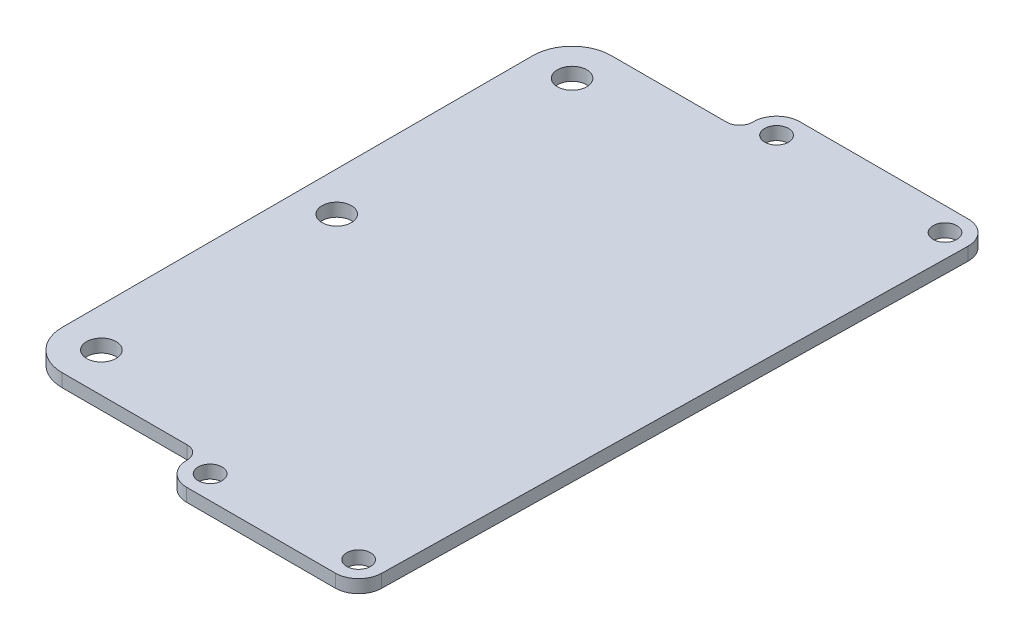
from build123d import *

# Parameters (mm, degrees)
BOSS_EXTRUDE1_START     = -12.827
BOSS_EXTRUDE1_DEPTH     = 3.175
M5_CLEARANCE_HOLE1_D    = 5.8
F_1_4_CLEARANCE_HOLE1_D = 7.14248
FILLET1_R               = 3.175


with BuildPart() as part:
    # Sketch1 → Boss-Extrude1 (new body)
    with BuildSketch(Plane(origin=(0, 144.904574554, 0), x_dir=(1, 0, 0), z_dir=(0, 1, 0)).offset(BOSS_EXTRUDE1_START)):
        with BuildLine():
            Line((-78.14945, -1144.867512521), (-37.25545, -1144.867512521))
            ThreePointArc((-37.25545, -1144.867512521), (-33.208181466, -1146.564417216), (-31.581293209, -1150.640334625))
            Line((-31.581293209, -1150.640334625), (-33.994293209, -1290.605977985))
            ThreePointArc((-33.994293209, -1290.605977985), (-35.690354742, -1294.555424368), (-39.66845, -1296.183155787))
            Line((-39.66845, -1296.183155787), (-75.73645, -1296.183155787))
            ThreePointArc((-75.73645, -1296.183155787), (-79.714545258, -1294.555424368), (-81.410606791, -1290.605977985))
            Line((-81.410606791, -1290.605977985), (-81.469319904, -1287.200334154))
            Line((-81.469319904, -1287.200334154), (-114.966812484, -1287.200334154))
            ThreePointArc((-114.966812484, -1287.200334154), (-121.702004575, -1284.410526245), (-124.491812484, -1277.675334154))
            Line((-124.491812484, -1277.675334154), (-124.491812484, -1220.525334154))
            Line((-124.491812484, -1220.525334154), (-124.491812484, -1163.375334154))
            ThreePointArc((-124.491812484, -1163.375334154), (-121.702004575, -1156.640142063), (-114.966812484, -1153.850334154))
            Line((-114.966812484, -1153.850334154), (-83.768266576, -1153.850334154))
            Line((-83.768266576, -1153.850334154), (-83.823606791, -1150.640334625))
            ThreePointArc((-83.823606791, -1150.640334625), (-82.196718534, -1146.564417216), (-78.14945, -1144.867512521))
        make_face()
    extrude(amount=-BOSS_EXTRUDE1_DEPTH)

    # M5 Clearance Hole1 (through all)
    with Locations(Plane(origin=(0, 128.902574554, 0), x_dir=(-1, 0, 0), z_dir=(0, -1, 0))):
        with Locations((39.66845, -1290.508155834), (75.73645, -1290.508155834), (37.25545, -1150.542512474), (78.14945, -1150.542512474)):
            Hole(M5_CLEARANCE_HOLE1_D / 2)

    # 1/4 Clearance Hole1 (through all)
    with Locations(Plane(origin=(0, 132.077574554, 0), x_dir=(1, 0, 0), z_dir=(0, 1, 0))):
        with Locations((-0.438087516, -1163.375334154), (-0.438087516, -1220.525334154), (-0.438087516, -1277.675334154), (-114.966812484, -1163.375334154), (-114.966812484, -1220.525334154), (-114.966812484, -1277.675334154)):
            Hole(F_1_4_CLEARANCE_HOLE1_D / 2)

    # Fillet1
    fillet1_edges = [part.edges().sort_by_distance(p)[0] for p in [
        (-81.469319904, 130.490074554, 1287.200334154),
        (-83.768266576, 130.490074554, 1153.850334154),
    ]]
    fillet(fillet1_edges, radius=FILLET1_R)


solid = part.part
